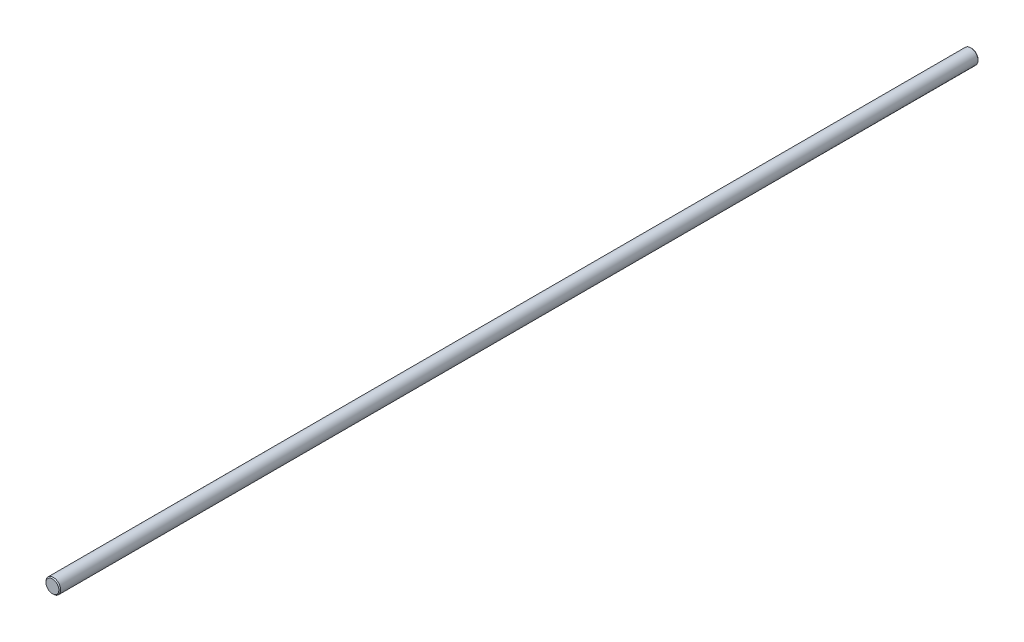
from build123d import *

# Parameters (mm, degrees)
SKETCH1_R           = 4
BOSS_EXTRUDE1_DEPTH = 500
CHAMFER1_SIZE       = 0.5


with BuildPart() as part:
    # Sketch1 → Boss-Extrude1 (new body)
    with BuildSketch(Plane.XY):
        Circle(SKETCH1_R)
    extrude(amount=BOSS_EXTRUDE1_DEPTH)

    # Chamfer1
    chamfer1_edges = [part.edges().sort_by_distance(p)[0] for p in [
        (-4, 0, 0),
        (-4, 0, 500),
    ]]
    chamfer(chamfer1_edges, length=CHAMFER1_SIZE)


solid = part.part
